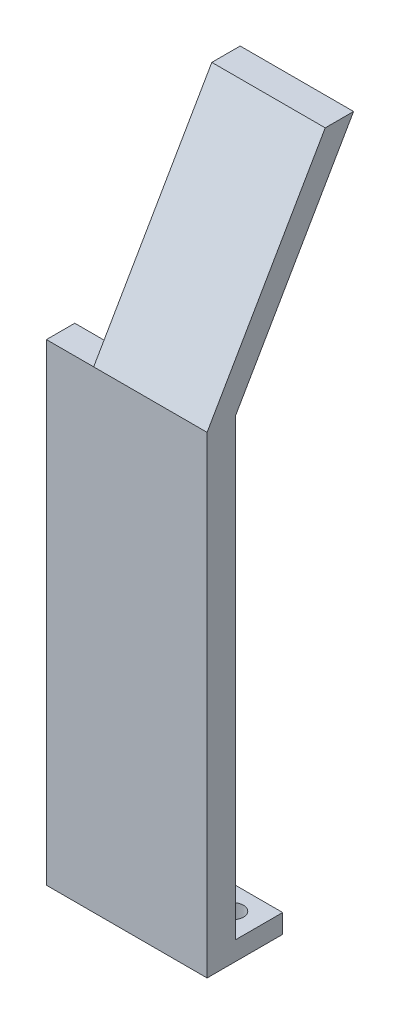
from build123d import *

# Parameters (mm, degrees)
SKETCH_1_W      = 17
SKETCH_1_H      = 5
SKETCH_1_R      = 1.1
EXTRUDE_1_DEPTH = 2
SKETCH_2_W      = 17
SKETCH_2_H      = 3
EXTRUDE_2_DEPTH = 50
EXTRUDE_3_DEPTH = 12


with BuildPart() as part:
    # 草图1 → 凸台-拉伸1 (new body)
    with BuildSketch(Plane(origin=(0, 0, 0), x_dir=(1, 0, 0), z_dir=(0, 1, 0))):
        Rectangle(SKETCH_1_W, SKETCH_1_H)
        with Locations(Location((5.75, 0, 0), (0, 0, 270))):
            Circle(SKETCH_1_R, mode=Mode.SUBTRACT)
        with Locations(Location((-5.75, 0, 0), (0, 0, 90))):
            Circle(SKETCH_1_R, mode=Mode.SUBTRACT)
        with Locations(Location((0, 0, 0), (0, 0, 270))):
            Circle(SKETCH_1_R, mode=Mode.SUBTRACT)
    extrude(amount=EXTRUDE_1_DEPTH)

    # 草图2 → 凸台-拉伸2 (add)
    with BuildSketch(Plane(origin=(0, 0, 0), x_dir=(1, 0, 0), z_dir=(0, 1, 0))):
        with Locations((0, -4)):
            Rectangle(SKETCH_2_W, SKETCH_2_H)
    extrude(amount=EXTRUDE_2_DEPTH)

    # 草图3 → 凸台-拉伸3 (add)
    with BuildSketch(Plane(origin=(8.5, 0, 0), x_dir=(0, 0, -1), z_dir=(1, 0, 0))):
        Polygon((-5.5, 50), (7, 71.650635095), (10, 71.650635095), (-2.5, 50), align=None)
    extrude(amount=-EXTRUDE_3_DEPTH)


solid = part.part
